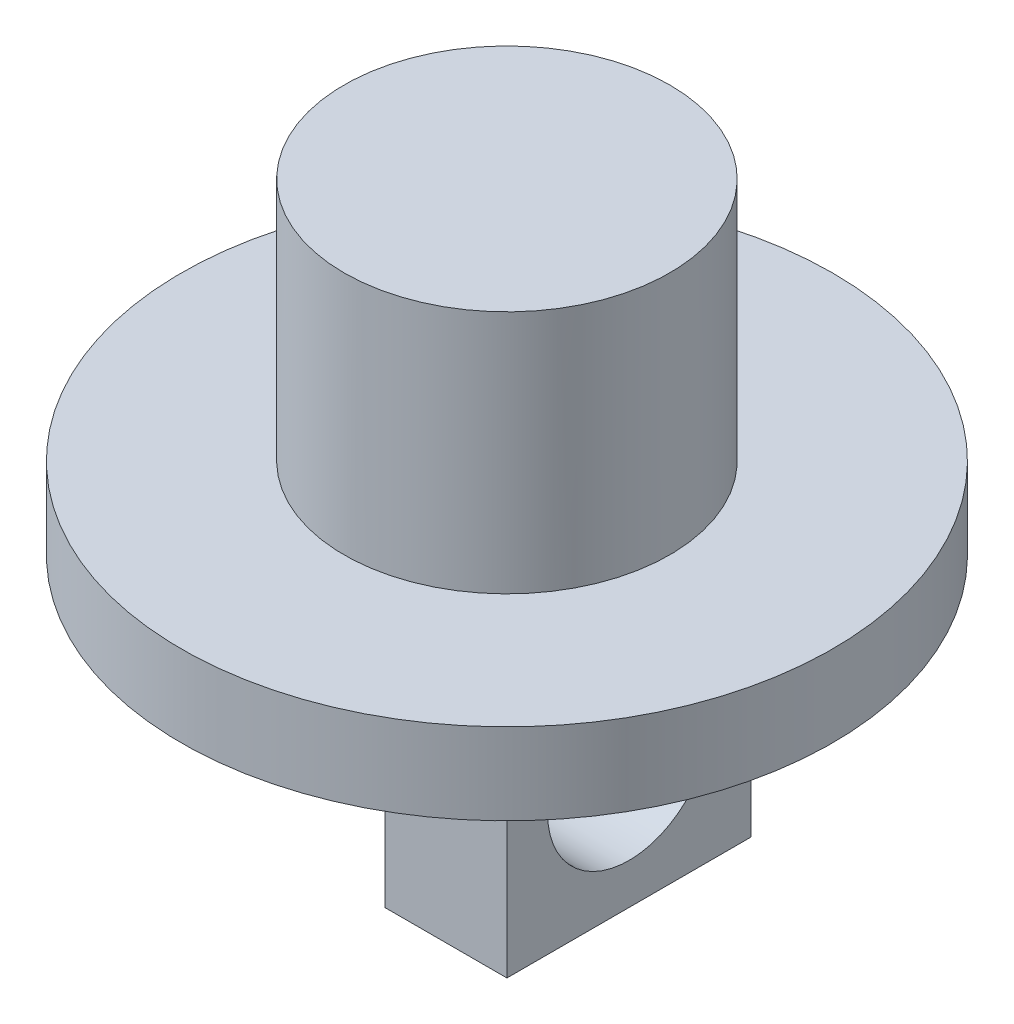
from build123d import *

# Parameters (mm, degrees)
SKETCH1_R           = 2.54
BOSS_EXTRUDE1_DEPTH = 5.08
SKETCH2_R           = 5.08
SKETCH2_R_2         = 2.54
BOSS_EXTRUDE2_DEPTH = 1.27
SKETCH3_W           = 1.905
SKETCH3_H           = 3.81
BOSS_EXTRUDE3_DEPTH = 3.81
CUT_EXTRUDE1_REACH  = 10.799
SKETCH4_R           = 1.27


with BuildPart() as part:
    # Sketch1 → Boss-Extrude1 (new body)
    with BuildSketch(Plane(origin=(0, 0, 0), x_dir=(1, 0, 0), z_dir=(0, 1, 0))):
        with Locations(Location((0, 0, 0), (0, 0, 270))):
            Circle(SKETCH1_R)
    extrude(amount=BOSS_EXTRUDE1_DEPTH)

    # Sketch2 → Boss-Extrude2 (add)
    with BuildSketch(Plane.XZ):
        with Locations(Location((0, 0, 0), (0, 0, 270))):
            Circle(SKETCH2_R)
        with Locations(Location((0, 0, 0), (0, 0, 270))):
            Circle(SKETCH2_R_2, mode=Mode.SUBTRACT)
    extrude(amount=-BOSS_EXTRUDE2_DEPTH)

    # Sketch3 → Boss-Extrude3 (add)
    with BuildSketch(Plane.XZ):
        with Locations((0.9525, 0)):
            Rectangle(SKETCH3_W, SKETCH3_H)
    extrude(amount=BOSS_EXTRUDE3_DEPTH)

    # Sketch4 → Cut-Extrude1 (cut, up to next)
    with BuildSketch(Plane.ZY, mode=Mode.PRIVATE) as cut_extrude1_sk1:
        with Locations((0, -1.905)):
            Circle(SKETCH4_R)
    cut_extrude1_tool1 = extrude(cut_extrude1_sk1.sketch, amount=-CUT_EXTRUDE1_REACH, mode=Mode.PRIVATE) & part.part
    add(cut_extrude1_tool1.solids().sort_by_distance((0, -1.905, 0))[0], mode=Mode.SUBTRACT)


solid = part.part
